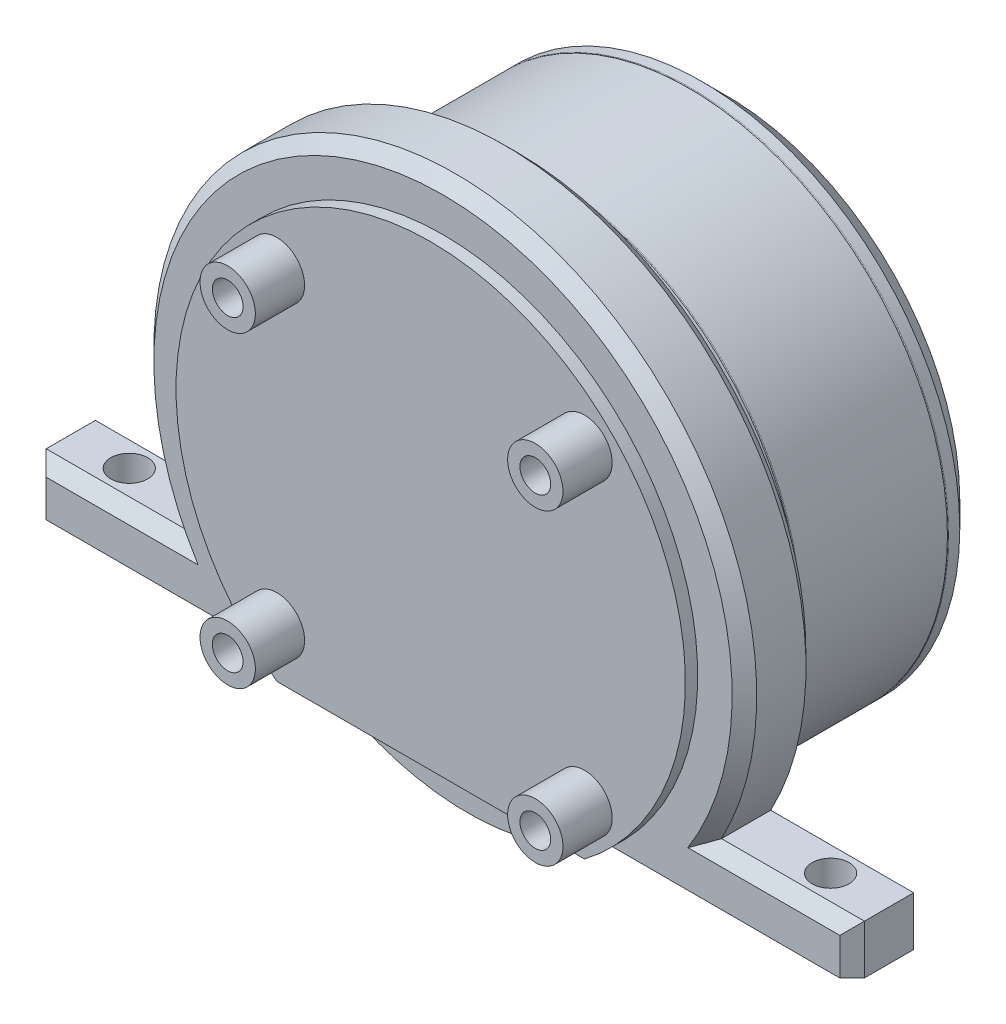
from build123d import *

# Parameters (mm, degrees)
SKETCH1_R               = 21
BOSS_EXTRUDE1_DEPTH     = 3
CHAMFER1_SIZE           = 2
FILLET1_R               = 0.1
SKETCH2_R               = 21
BOSS_EXTRUDE2_DEPTH     = 12
FILLET2_R               = 0.1
SKETCH3_R               = 21
BOSS_EXTRUDE3_DEPTH     = 6
SKETCH4_R               = 3
SKETCH4_R_2             = 1.5
CUT_EXTRUDE1_DEPTH      = 6
BOSS_EXTRUDE4_DEPTH     = 6
CHAMFER2_SIZE           = 1
CUT_EXTRUDE2_DEPTH      = 55.134670037
CUT_EXTRUDE2_DEPTH_BACK = 55.134670037
SKETCH6_R               = 1.5
BOSS_EXTRUDE5_DEPTH     = 1
SKETCH8_R               = 2.25
BOSS_EXTRUDE6_DEPTH     = 4
SKETCH9_R               = 1.25
CUT_EXTRUDE3_DEPTH      = 4


with BuildPart() as part:
    # Sketch1 → Boss-Extrude1 (new body)
    with BuildSketch(Plane.XY):
        Circle(SKETCH1_R)
    extrude(amount=BOSS_EXTRUDE1_DEPTH)

    # Chamfer1
    chamfer1_edges = [part.edges().sort_by_distance(p)[0] for p in [
        (-21, 0, 0),
    ]]
    chamfer(chamfer1_edges, length=CHAMFER1_SIZE)

    # Fillet1
    fillet1_edges = [part.edges().sort_by_distance(p)[0] for p in [
        (-21, 0, 3),
    ]]
    fillet(fillet1_edges, radius=FILLET1_R)

    # Sketch2 → Boss-Extrude2 (add)
    with BuildSketch(Plane.XY.offset(3)):
        Circle(SKETCH2_R)
    extrude(amount=BOSS_EXTRUDE2_DEPTH)

    # Fillet2
    fillet2_edges = [part.edges().sort_by_distance(p)[0] for p in [
        (-21, 0, 15),
    ]]
    fillet(fillet2_edges, radius=FILLET2_R)

    # Sketch3 → Boss-Extrude3 (add)
    with BuildSketch(Plane.XY.offset(15)):
        Circle(SKETCH3_R)
    extrude(amount=BOSS_EXTRUDE3_DEPTH)

    # Sketch4 → Cut-Extrude1 (cut)
    with BuildSketch(Plane(origin=(0, 0, 0), x_dir=(-1, 0, 0), z_dir=(0, 0, -1))):
        Circle(SKETCH4_R)
        with Locations((-10, 0)):
            Circle(SKETCH4_R_2)
        with Locations((0, 10)):
            Circle(SKETCH4_R_2)
        with Locations((10, 0)):
            Circle(SKETCH4_R_2)
        with Locations((0, -10)):
            Circle(SKETCH4_R_2)
    extrude(amount=-CUT_EXTRUDE1_DEPTH, mode=Mode.SUBTRACT)

    # Sketch5 → Boss-Extrude4 (add)
    with BuildSketch(Plane.XY.offset(17)):
        with BuildLine():
            Line((21.633307653, -11.5), (33.25, -11.5))
            Line((33.25, -11.5), (33.25, -15.5))
            Line((33.25, -15.5), (-33.25, -15.5))
            Line((-33.25, -15.5), (-33.25, -11.5))
            Line((-33.25, -11.5), (-21.633307653, -11.5))
            ThreePointArc((-21.633307653, -11.5), (0, 24.5), (21.633307653, -11.5))
        make_face()
    extrude(amount=BOSS_EXTRUDE4_DEPTH)

    # Chamfer2
    chamfer2_edges = [part.edges().sort_by_distance(p)[0] for p in [
        (0, 24.5, 17),
        (-27.441653826, -11.5, 17),
        (-33.25, -13.5, 17),
        (33.25, -13.5, 17),
        (27.441653826, -11.5, 17),
        (0, 24.5, 23),
        (-27.441653826, -11.5, 23),
        (-33.25, -13.5, 23),
        (33.25, -13.5, 23),
        (27.441653826, -11.5, 23),
    ]]
    chamfer(chamfer2_edges, length=CHAMFER2_SIZE)

    # Sketch6 → Cut-Extrude2 (cut, two sides: drawn at the far end of the back side and taken through both)
    with BuildSketch(Plane(origin=(0, -11.5, 0), x_dir=(1, 0, 0), z_dir=(0, 1, 0)).offset(-CUT_EXTRUDE2_DEPTH_BACK)):
        with Locations(Location((-28.5, -20, 0), (0, 0, 180))):
            Circle(SKETCH6_R)
        with Locations(Location((28.5, -20, 0), (0, 0, 180))):
            Circle(SKETCH6_R)
    extrude(amount=CUT_EXTRUDE2_DEPTH + CUT_EXTRUDE2_DEPTH_BACK, mode=Mode.SUBTRACT)

    # Sketch7 → Boss-Extrude5 (add)
    with BuildSketch(Plane.XY.offset(23)):
        with BuildLine():
            Line((12.499599994, -16.5), (-12.499599994, -16.5))
            ThreePointArc((-12.499599994, -16.5), (0, 20.7), (12.499599994, -16.5))
        make_face()
    extrude(amount=BOSS_EXTRUDE5_DEPTH)

    # Sketch8 → Boss-Extrude6 (add)
    with BuildSketch(Plane.XY.offset(24)):
        with Locations((-12.5, 12.5)):
            Circle(SKETCH8_R)
        with Locations((12.5, 12.5)):
            Circle(SKETCH8_R)
        with Locations((12.5, -12.5)):
            Circle(SKETCH8_R)
        with Locations((-12.5, -12.5)):
            Circle(SKETCH8_R)
    extrude(amount=BOSS_EXTRUDE6_DEPTH)

    # Sketch9 → Cut-Extrude3 (cut)
    with BuildSketch(Plane.XY.offset(28)):
        with Locations((12.5, 12.5)):
            Circle(SKETCH9_R)
        with Locations((12.5, -12.5)):
            Circle(SKETCH9_R)
        with Locations((-12.5, 12.5)):
            Circle(SKETCH9_R)
        with Locations((-12.5, -12.5)):
            Circle(SKETCH9_R)
    extrude(amount=-CUT_EXTRUDE3_DEPTH, mode=Mode.SUBTRACT)


solid = part.part
